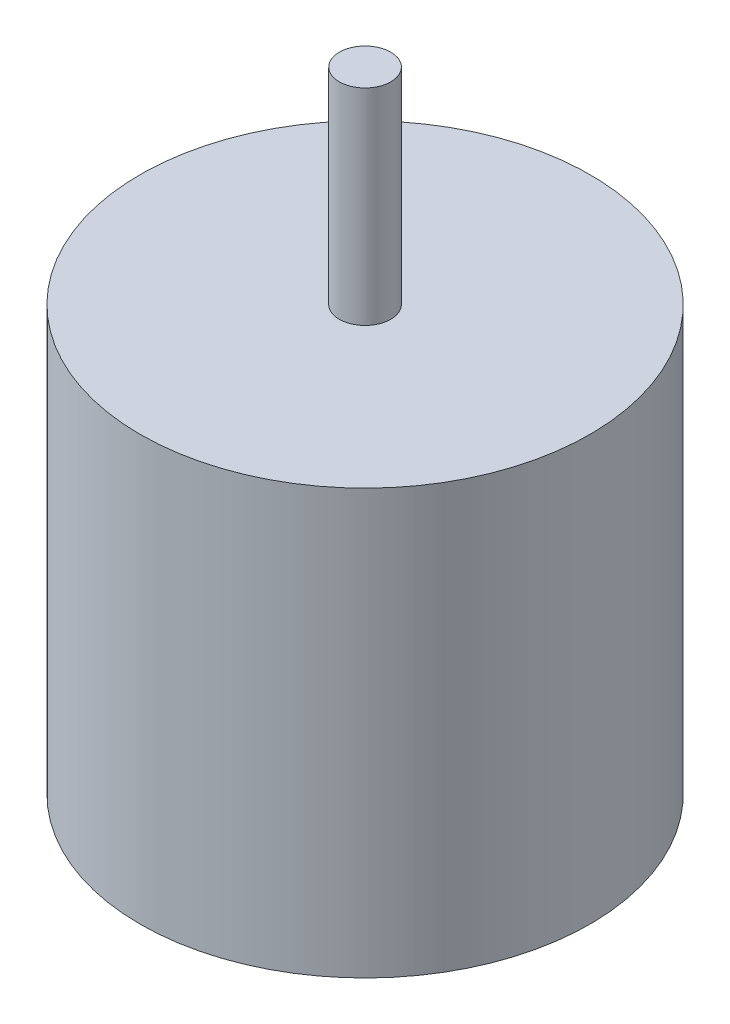
from build123d import *

# Parameters (mm, degrees)
SKETCH1_R           = 17.5
BOSS_EXTRUDE1_DEPTH = 33
SKETCH2_R           = 2
BOSS_EXTRUDE2_DEPTH = 16


with BuildPart() as part:
    # Sketch1 → Boss-Extrude1 (new body)
    with BuildSketch(Plane(origin=(0, 0, 0), x_dir=(1, 0, 0), z_dir=(0, 1, 0))):
        with Locations(Location((0, 0, 0), (0, 0, 270))):
            Circle(SKETCH1_R)
    extrude(amount=BOSS_EXTRUDE1_DEPTH)

    # Sketch2 → Boss-Extrude2 (add)
    with BuildSketch(Plane(origin=(0, 33, 0), x_dir=(1, 0, 0), z_dir=(0, 1, 0))):
        with Locations(Location((0, 0, 0), (0, 0, 270))):
            Circle(SKETCH2_R)
    extrude(amount=BOSS_EXTRUDE2_DEPTH)


solid = part.part
